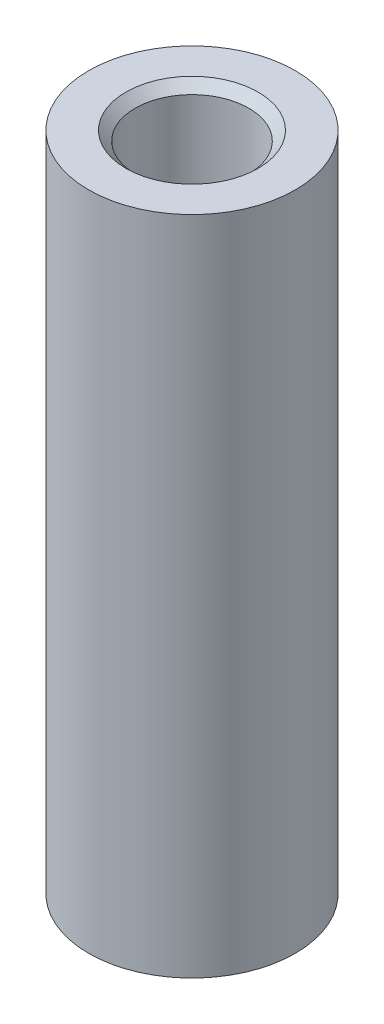
from build123d import *

# Parameters (mm, degrees)
SKETCH1_R                         = 15.875
BOSS_EXTRUDE1_DEPTH               = 101.6
F_3_4_16_TAPPED_HOLE1_D           = 17.4625
F_3_4_16_TAPPED_HOLE1_DEPTH       = 42.926
F_3_4_16_TAPPED_HOLE1_CSINK_D     = 20.32
F_3_4_16_TAPPED_HOLE1_CSINK_ANGLE = 90
F_3_4_16_TAPPED_HOLE1_TIP         = 5.24626428


with BuildPart() as part:
    # Sketch1 → Boss-Extrude1 (new body)
    with BuildSketch(Plane(origin=(0, 0, 0), x_dir=(-1, 0, 0), z_dir=(0, 1, 0))):
        with Locations(Location((0, 0, 0), (0, 0, 90))):
            Circle(SKETCH1_R)
    extrude(amount=BOSS_EXTRUDE1_DEPTH)

    # Sketch2 → Cut-Revolve1 (revolve, cut)
    with BuildSketch(Plane(origin=(0, 0, 0), x_dir=(0, 1, 0), z_dir=(0, 0, 1)), mode=Mode.PRIVATE) as cut_revolve1_sk:
        Polygon((0, -6.35), (0, 0), (8.678122072, 0), (4.862657141, -6.35), align=None)
    revolve(cut_revolve1_sk.sketch.rotate(Axis((0, 0, 0), (0, 1, 0)), 90), axis=Axis((0, 0, 0), (0, 1, 0)), mode=Mode.SUBTRACT)

    # 3/4-16 Tapped Hole1
    with Locations(Plane(origin=(0, 101.6, 0), x_dir=(-1, 0, 0), z_dir=(0, 1, 0))):
        with Locations((0, 0)):
            CounterSinkHole(F_3_4_16_TAPPED_HOLE1_D / 2, F_3_4_16_TAPPED_HOLE1_CSINK_D / 2, depth=F_3_4_16_TAPPED_HOLE1_DEPTH, counter_sink_angle=F_3_4_16_TAPPED_HOLE1_CSINK_ANGLE)
            with Locations((0, 0, -(F_3_4_16_TAPPED_HOLE1_DEPTH + F_3_4_16_TAPPED_HOLE1_TIP / 2))):  # 118° drill point
                Cone(0, F_3_4_16_TAPPED_HOLE1_D / 2, F_3_4_16_TAPPED_HOLE1_TIP, mode=Mode.SUBTRACT)


solid = part.part
